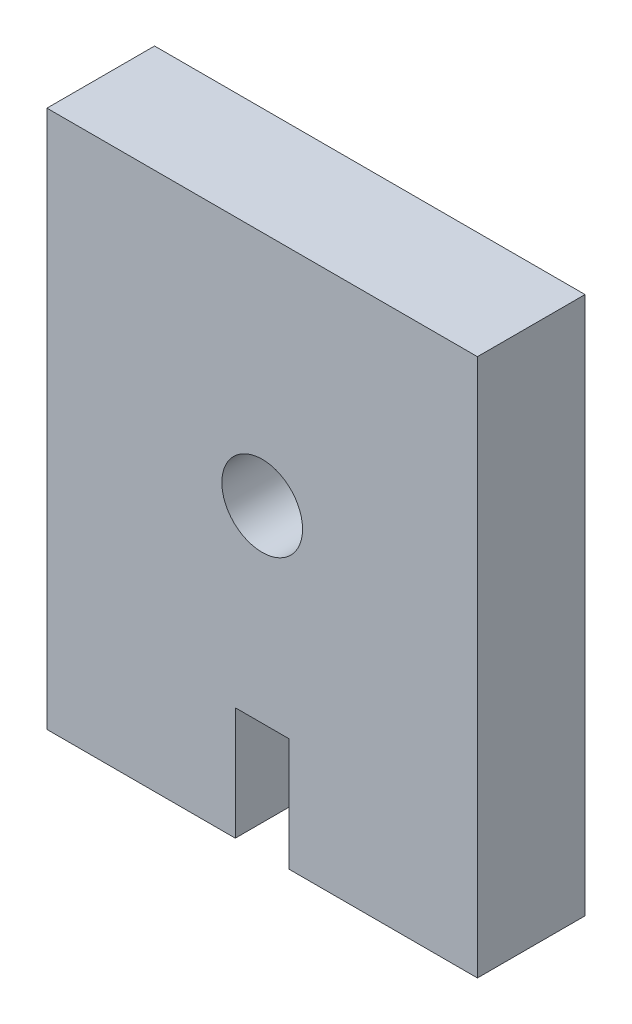
from build123d import *

# Parameters (mm, degrees)
SKETCH1_W           = 160
SKETCH1_H           = 200
BOSS_EXTRUDE1_DEPTH = 40
SKETCH2_W           = 20
SKETCH2_H           = 29
CUT_EXTRUDE1_DEPTH  = 42
SKETCH3_R           = 15
CUT_EXTRUDE2_DEPTH  = 25


with BuildPart() as part:
    # Sketch1 → Boss-Extrude1 (new body)
    with BuildSketch(Plane.XY):
        with Locations((0, -20)):
            Rectangle(SKETCH1_W, SKETCH1_H)
    extrude(amount=BOSS_EXTRUDE1_DEPTH)

    # Sketch2 → Cut-Extrude1 (cut)
    with BuildSketch(Plane.XZ.offset(120)):
        with Locations((0, 25.5)):
            Rectangle(SKETCH2_W, SKETCH2_H)
    extrude(amount=-CUT_EXTRUDE1_DEPTH, mode=Mode.SUBTRACT)

    # Sketch3 → Cut-Extrude2 (cut)
    with BuildSketch(Plane.XY.offset(40)):
        with Locations((0, -8)):
            Circle(SKETCH3_R)
    extrude(amount=-CUT_EXTRUDE2_DEPTH, mode=Mode.SUBTRACT)


solid = part.part
